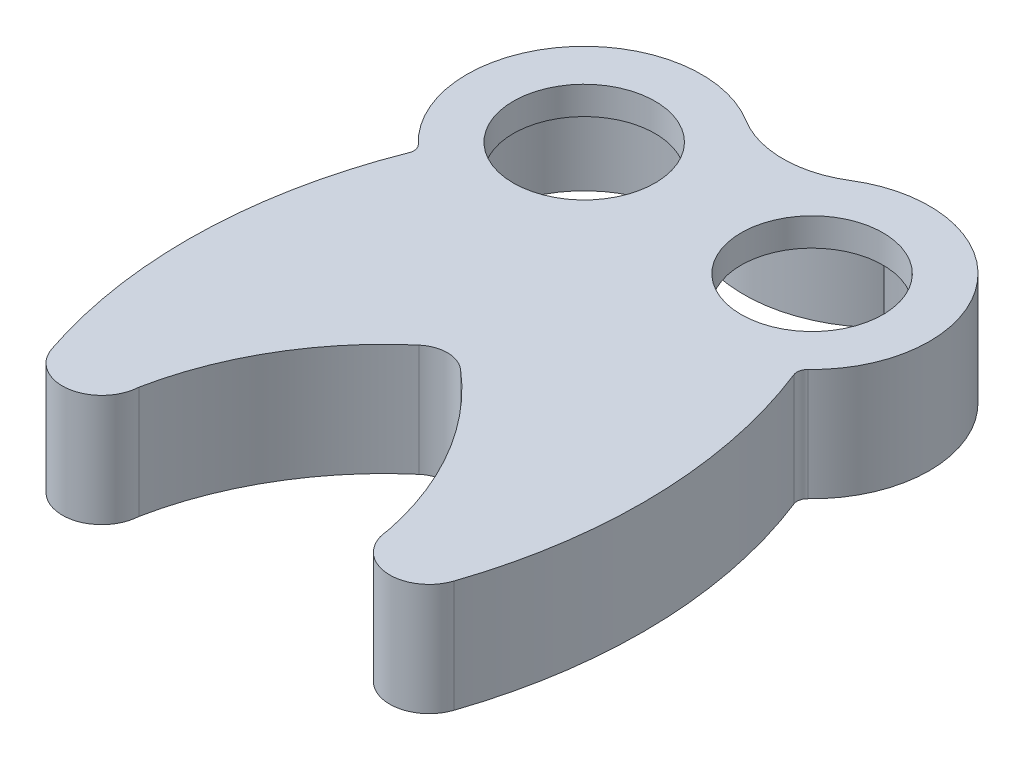
from build123d import *

# Parameters (mm, degrees)
VYSUNOUT_TENKOST_NN_1_DEPTH   = 9
VYSUNOUT_TENKOST_NN_2_DEPTH   = 7.5
VYSUNOUT_TENKOST_NN_2_2_DEPTH = 7.5
P_IDAT_VYSUNUT_M2_DEPTH       = 3
VYSUNOUT_START                = 3
VYSUNOUT_TENKOST_NN_3_DEPTH   = 3
SKICA4_R                      = 7.599478253
ODEBRAT_VYSUNUT_M1_DEPTH      = 10


with BuildPart() as part:
    # Skica3 → Vysunout tenkostěnný1 (new body)
    with BuildSketch(Plane(origin=(0, 0, 0), x_dir=(1, 0, 0), z_dir=(0, 1, 0))):
        with BuildLine():
            ThreePointArc((13.318818193, -36.180678557), (16.919790609, -40.236611382), (21.547993361, -37.408655814))
            ThreePointArc((21.547993361, -37.408655814), (24.391270235, -18.641089057), (20.614348293, -0.038921281))
            ThreePointArc((20.614348293, -0.038921281), (20.561150024, 0.629518412), (20.890277717, 1.213741521))
            ThreePointArc((20.890277717, 1.213741521), (22.159844041, 18.012545588), (5.58094625, 21.004495587))
            ThreePointArc((5.58094625, 21.004495587), (0, 19.413874141), (-5.58094625, 21.004495587))
            ThreePointArc((-5.58094625, 21.004495587), (-22.159844041, 18.012545588), (-20.890277717, 1.213741521))
            ThreePointArc((-20.890277717, 1.213741521), (-20.561150024, 0.629518412), (-20.614348293, -0.038921281))
            ThreePointArc((-20.614348293, -0.038921281), (-24.391270235, -18.641089057), (-21.547993361, -37.408655814))
            ThreePointArc((-21.547993361, -37.408655814), (-16.919790609, -40.236611382), (-13.318818193, -36.180678557))
            Line((-13.318818193, -36.180678557), (-15.317951996, -36.121822462))
            ThreePointArc((-15.317951996, -36.121822462), (-17.214967104, -38.2585136), (-19.653133669, -36.768728669))
            ThreePointArc((-19.653133669, -36.768728669), (-22.391894143, -18.691041449), (-18.753808587, -0.772673285))
            ThreePointArc((-18.753808587, -0.772673285), (-18.607973584, 1.059752989), (-19.510227352, 2.661312241))
            ThreePointArc((-19.510227352, 2.661312241), (-20.577911445, 16.788826149), (-6.635335046, 19.305006173))
            ThreePointArc((-6.635335046, 19.305006173), (0, 17.413874141), (6.635335046, 19.305006173))
            ThreePointArc((6.635335046, 19.305006173), (20.577911445, 16.788826149), (19.510227352, 2.661312241))
            ThreePointArc((19.510227352, 2.661312241), (18.607973584, 1.059752989), (18.753808587, -0.772673285))
            ThreePointArc((18.753808587, -0.772673285), (22.391894143, -18.691041449), (19.653133669, -36.768728669))
            ThreePointArc((19.653133669, -36.768728669), (17.214967104, -38.2585136), (15.317951996, -36.121822462))
            Line((15.317951996, -36.121822462), (13.318818193, -36.180678557))
        make_face()
        with BuildLine():
            ThreePointArc((15.479480606, -36.942506696), (11.363736232, -25.348385806), (3.532419897, -15.859788681))
            ThreePointArc((3.532419897, -15.859788681), (0, -14.557634697), (-3.532419897, -15.859788681))
            ThreePointArc((-3.532419897, -15.859788681), (-11.363736232, -25.348385806), (-15.479480606, -36.942506696))
            Line((-15.479480606, -36.942506696), (-13.507192877, -37.274291437))
            ThreePointArc((-13.507192877, -37.274291437), (-9.623698487, -26.334422643), (-2.234300531, -17.38126366))
            ThreePointArc((-2.234300531, -17.38126366), (0, -16.557634697), (2.234300531, -17.38126366))
            ThreePointArc((2.234300531, -17.38126366), (9.623698487, -26.334422643), (13.507192877, -37.274291437))
            Line((13.507192877, -37.274291437), (15.479480606, -36.942506696))
        make_face()
    extrude(amount=-VYSUNOUT_TENKOST_NN_1_DEPTH)



with BuildPart() as body_2:
    # Skica3<3> → Vysunout tenkostěnný2 (new body)
    with BuildSketch(Plane(origin=(0, 0, 0), x_dir=(1, 0, 0), z_dir=(0, 1, 0))):
        with BuildLine():
            ThreePointArc((-9.651511204, 20.15475088), (0.145367606, 16.213794321), (9.85696713, 20.360456559))
            Line((9.85696713, 20.360456559), (10.571915059, 19.661278857))
            ThreePointArc((10.571915059, 19.661278857), (0.155911444, 15.213849909), (-10.351556954, 19.440652884))
            Line((-10.351556954, 19.440652884), (-9.651511204, 20.15475088))
        make_face()
    extrude(amount=-VYSUNOUT_TENKOST_NN_2_DEPTH)


with BuildPart() as body_3:
    # Skica3<3> → Vysunout tenkost_nn_2 2 (new body)
    with BuildSketch(Plane(origin=(0, 0, 0), x_dir=(1, 0, 0), z_dir=(0, 1, 0))):
        with BuildLine():
            ThreePointArc((-14.318385094, -0.405797283), (-0.353145852, -5.812609189), (13.842408307, -1.043147566))
            Line((13.842408307, -1.043147566), (14.464095548, -1.82641315))
            ThreePointArc((14.464095548, -1.82641315), (-0.375772598, -6.812353171), (-14.974872193, -1.160134535))
            Line((-14.974872193, -1.160134535), (-14.318385094, -0.405797283))
        make_face()
    extrude(amount=-VYSUNOUT_TENKOST_NN_2_2_DEPTH)


with BuildPart() as part_1:
    add(part.part)

    add(body_2.part)  # Přidat vysunutím2 merges body 2

    add(body_3.part)  # Přidat vysunutím2 merges body 3
    # Skica3<4> → Přidat vysunutím2 (add)
    with BuildSketch(Plane(origin=(0, 0, 0), x_dir=(1, 0, 0), z_dir=(0, 1, 0))):
        with BuildLine():
            ThreePointArc((6.108140648, 20.15475088), (0, 18.413874141), (-6.108140648, 20.15475088))
            ThreePointArc((-6.108140648, 20.15475088), (-21.368877743, 17.400685868), (-20.200252534, 1.937526881))
            ThreePointArc((-20.200252534, 1.937526881), (-19.584561804, 0.844635701), (-19.68407844, -0.405797283))
            ThreePointArc((-19.68407844, -0.405797283), (-23.391582189, -18.666065253), (-20.600563515, -37.088692241))
            ThreePointArc((-20.600563515, -37.088692241), (-17.553998549, -39.282880534), (-14.493336742, -37.108399066))
            ThreePointArc((-14.493336742, -37.108399066), (-10.493717359, -25.841404225), (-2.883360214, -16.620526171))
            ThreePointArc((-2.883360214, -16.620526171), (0, -15.557634697), (2.883360214, -16.620526171))
            ThreePointArc((2.883360214, -16.620526171), (10.493717359, -25.841404225), (14.493336742, -37.108399066))
            ThreePointArc((14.493336742, -37.108399066), (17.553998549, -39.282880534), (20.600563515, -37.088692241))
            ThreePointArc((20.600563515, -37.088692241), (23.391582189, -18.666065253), (19.68407844, -0.405797283))
            ThreePointArc((19.68407844, -0.405797283), (19.584561804, 0.844635701), (20.200252534, 1.937526881))
            ThreePointArc((20.200252534, 1.937526881), (21.368877743, 17.400685868), (6.108140648, 20.15475088))
        make_face()
    extrude(amount=P_IDAT_VYSUNUT_M2_DEPTH)

    # Skica3<5> → Vysunout tenkostěnný3 (add)
    with BuildSketch(Plane(origin=(0, 0, 0), x_dir=(1, 0, 0), z_dir=(0, 1, 0)).offset(VYSUNOUT_START)):
        with BuildLine():
            ThreePointArc((13.318818193, -36.180678557), (16.919790609, -40.236611382), (21.547993361, -37.408655814))
            ThreePointArc((21.547993361, -37.408655814), (24.391270235, -18.641089057), (20.614348293, -0.038921281))
            ThreePointArc((20.614348293, -0.038921281), (20.561150024, 0.629518412), (20.890277717, 1.213741521))
            ThreePointArc((20.890277717, 1.213741521), (22.159844041, 18.012545588), (5.58094625, 21.004495587))
            ThreePointArc((5.58094625, 21.004495587), (0, 19.413874141), (-5.58094625, 21.004495587))
            ThreePointArc((-5.58094625, 21.004495587), (-22.159844041, 18.012545588), (-20.890277717, 1.213741521))
            ThreePointArc((-20.890277717, 1.213741521), (-20.561150024, 0.629518412), (-20.614348293, -0.038921281))
            ThreePointArc((-20.614348293, -0.038921281), (-24.391270235, -18.641089057), (-21.547993361, -37.408655814))
            ThreePointArc((-21.547993361, -37.408655814), (-16.919790609, -40.236611382), (-13.318818193, -36.180678557))
            Line((-13.318818193, -36.180678557), (-15.317951996, -36.121822462))
            ThreePointArc((-15.317951996, -36.121822462), (-17.214967104, -38.2585136), (-19.653133669, -36.768728669))
            ThreePointArc((-19.653133669, -36.768728669), (-22.391894143, -18.691041449), (-18.753808587, -0.772673285))
            ThreePointArc((-18.753808587, -0.772673285), (-18.607973584, 1.059752989), (-19.510227352, 2.661312241))
            ThreePointArc((-19.510227352, 2.661312241), (-20.577911445, 16.788826149), (-6.635335046, 19.305006173))
            ThreePointArc((-6.635335046, 19.305006173), (0, 17.413874141), (6.635335046, 19.305006173))
            ThreePointArc((6.635335046, 19.305006173), (20.577911445, 16.788826149), (19.510227352, 2.661312241))
            ThreePointArc((19.510227352, 2.661312241), (18.607973584, 1.059752989), (18.753808587, -0.772673285))
            ThreePointArc((18.753808587, -0.772673285), (22.391894143, -18.691041449), (19.653133669, -36.768728669))
            ThreePointArc((19.653133669, -36.768728669), (17.214967104, -38.2585136), (15.317951996, -36.121822462))
            Line((15.317951996, -36.121822462), (13.318818193, -36.180678557))
        make_face()
        with BuildLine():
            ThreePointArc((15.479480606, -36.942506696), (11.363736232, -25.348385806), (3.532419897, -15.859788681))
            ThreePointArc((3.532419897, -15.859788681), (0, -14.557634697), (-3.532419897, -15.859788681))
            ThreePointArc((-3.532419897, -15.859788681), (-11.363736232, -25.348385806), (-15.479480606, -36.942506696))
            Line((-15.479480606, -36.942506696), (-13.507192877, -37.274291437))
            ThreePointArc((-13.507192877, -37.274291437), (-9.623698487, -26.334422643), (-2.234300531, -17.38126366))
            ThreePointArc((-2.234300531, -17.38126366), (0, -16.557634697), (2.234300531, -17.38126366))
            ThreePointArc((2.234300531, -17.38126366), (9.623698487, -26.334422643), (13.507192877, -37.274291437))
            Line((13.507192877, -37.274291437), (15.479480606, -36.942506696))
        make_face()
        with BuildLine():
            ThreePointArc((-10.351556954, 19.440652884), (0.155911444, 15.213849909), (10.571915059, 19.661278857))
            Line((10.571915059, 19.661278857), (9.1420192, 21.05963426))
            ThreePointArc((9.1420192, 21.05963426), (0.134823768, 17.213738734), (-8.951465454, 20.868848876))
            Line((-8.951465454, 20.868848876), (-10.351556954, 19.440652884))
        make_face()
        with BuildLine():
            ThreePointArc((-14.974872193, -1.160134535), (-0.375772598, -6.812353171), (14.464095548, -1.82641315))
            Line((14.464095548, -1.82641315), (13.220721067, -0.259881982))
            ThreePointArc((13.220721067, -0.259881982), (-0.330519107, -4.812865207), (-13.661897996, 0.348539969))
            Line((-13.661897996, 0.348539969), (-14.974872193, -1.160134535))
        make_face()
    extrude(amount=-VYSUNOUT_TENKOST_NN_3_DEPTH)

    # Skica4 → Odebrat vysunutím1 (cut)
    with BuildSketch(Plane(origin=(0, 0, 0), x_dir=(1, 0, 0), z_dir=(0, 1, 0))):
        with Locations((-12.211626463, 10.317004534)):
            Circle(SKICA4_R)
        with Locations((12.211626463, 10.317004534)):
            Circle(SKICA4_R)
    extrude(amount=ODEBRAT_VYSUNUT_M1_DEPTH, mode=Mode.SUBTRACT)


solid = part_1.part
